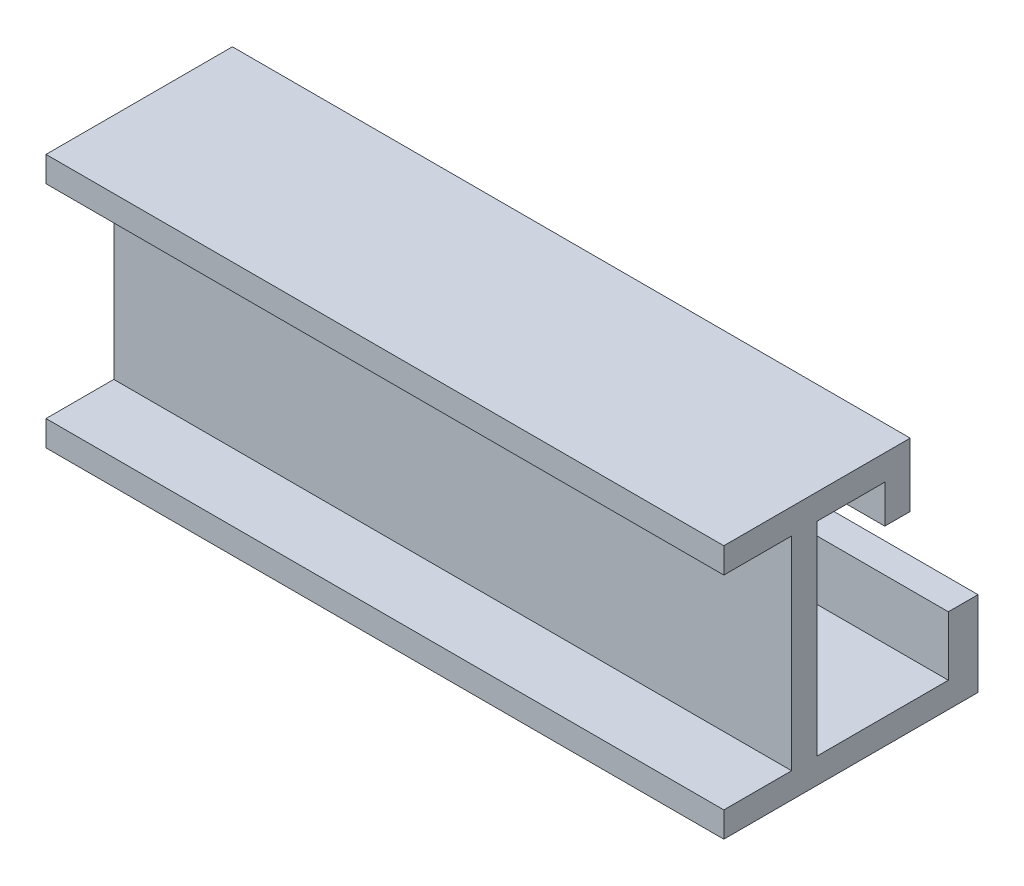
from build123d import *

# Parameters (mm, degrees)
EXTRUDE_1_DEPTH = 80


with BuildPart() as part:
    # Эскиз1 → Бобышка-Вытянуть1 (new, symmetric)
    with BuildSketch(Plane(origin=(0, 0, 0), x_dir=(0, 0, -1), z_dir=(1, 0, 0))):
        Polygon((-30, -24), (-30, -30), (30, -30), (30, -10), (23, -10), (23, -24), (8, -24), (-8, -24), (-8, 24), (8, 24), (8, 15), (14, 15), (14, 30), (-30, 30), (-30, 24), (-14, 24), (-14, -24), align=None)
    extrude(amount=EXTRUDE_1_DEPTH, both=True)


solid = part.part
